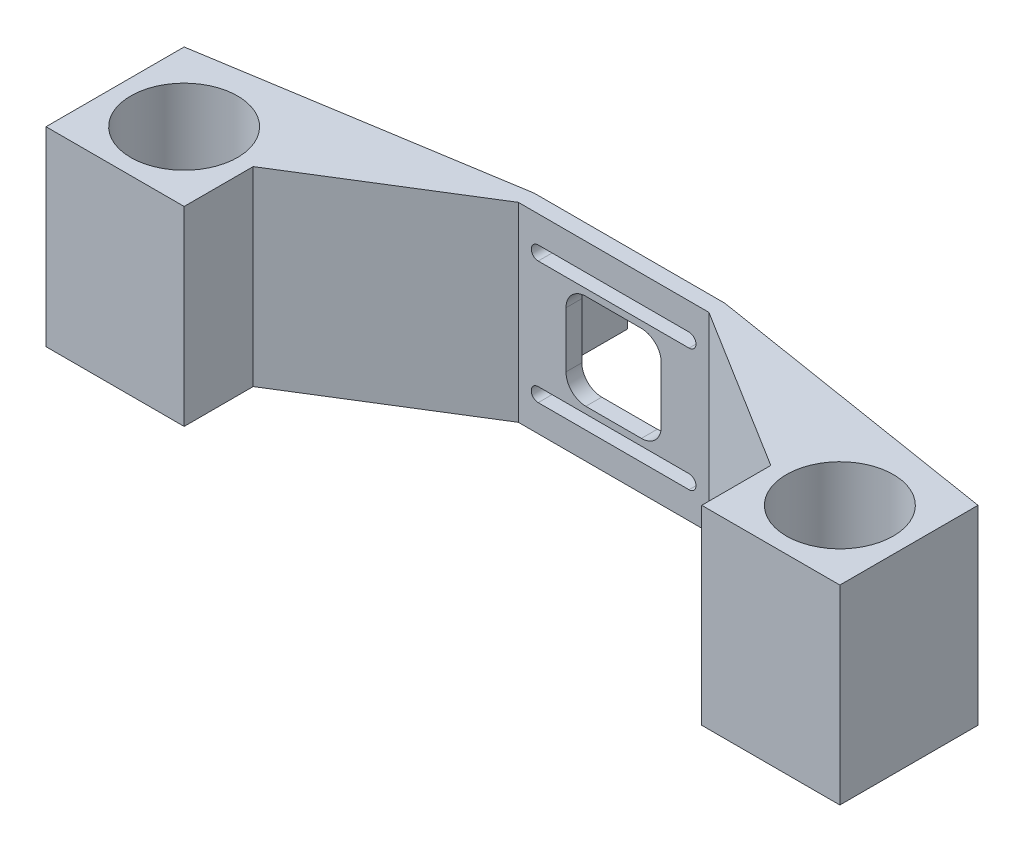
from build123d import *

# Parameters (mm, degrees)
SKETCH2_R                = 13.45
BOSS_EXTRUDE1_DEPTH      = 48
CUT_EXTRUDE1_DEPTH       = 10
BOSS_EXTRUDE2_DEPTH      = 13
BOSS_EXTRUDE2_DEPTH_BACK = 2
SKETCH5_W                = 14
SKETCH5_H                = 14
SKETCH5_R                = 4.1


with BuildPart() as part:
    # Sketch2 → Boss-Extrude1 (new body)
    with BuildSketch(Plane(origin=(0, 0, 0), x_dir=(1, 0, 0), z_dir=(0, 1, 0))):
        Polygon((-17.4, -17.4), (17.4, -17.4), (17.4, 0), (58.6, 25.6), (82.6, 25.6), (82.6, 29.6), (58.6, 29.6), (-17.4, 17.4), align=None)
        with Locations(Location((0, 0, 0), (0, 0, 270))):
            Circle(SKETCH2_R, mode=Mode.SUBTRACT)
    boss_extrude1 = extrude(amount=BOSS_EXTRUDE1_DEPTH)

    # Mirror1: Boss-Extrude1 across plane
    add(boss_extrude1.mirror(Plane(origin=(82.6, 0, 0), x_dir=(0, 0, 1), z_dir=(1, 0, 0))))

    # Sketch4 → Cut-Extrude1 (cut)
    with BuildSketch(Plane(origin=(0, 0, -29.6), x_dir=(-1, 0, 0), z_dir=(0, 0, -1))):
        with BuildLine():
            Line((-101.6, 10.3), (-63.6, 10.3))
            ThreePointArc((-63.6, 10.3), (-61.85, 8.55), (-63.6, 6.8))
            Line((-63.6, 6.8), (-101.6, 6.8))
            ThreePointArc((-101.6, 6.8), (-103.35, 8.55), (-101.6, 10.3))
        make_face()
        with BuildLine():
            Line((-101.6, 37.7), (-63.6, 37.7))
            ThreePointArc((-63.6, 37.7), (-61.85, 39.45), (-63.6, 41.2))
            Line((-63.6, 41.2), (-101.6, 41.2))
            ThreePointArc((-101.6, 41.2), (-103.35, 39.45), (-101.6, 37.7))
        make_face()
        with BuildLine():
            Line((-89.6, 12), (-75.6, 12))
            ThreePointArc((-75.6, 12), (-72.064466094, 13.464466094), (-70.6, 17))
            Line((-70.6, 17), (-70.6, 31))
            ThreePointArc((-70.6, 31), (-72.064466094, 34.535533906), (-75.6, 36))
            Line((-75.6, 36), (-89.6, 36))
            ThreePointArc((-89.6, 36), (-93.135533906, 34.535533906), (-94.6, 31))
            Line((-94.6, 31), (-94.6, 17))
            ThreePointArc((-94.6, 17), (-93.135533906, 13.464466094), (-89.6, 12))
        make_face()
    extrude(amount=-CUT_EXTRUDE1_DEPTH, mode=Mode.SUBTRACT)

    # Sketch5 → Boss-Extrude2 (add, two sides: drawn at the far end of the back side and taken through both)
    with BuildSketch(Plane(origin=(0, 0, -29.6), x_dir=(-1, 0, 0), z_dir=(0, 0, -1)).offset(-BOSS_EXTRUDE2_DEPTH_BACK)):
        with Locations((-62.1, 24.09990131)):
            Rectangle(SKETCH5_W, SKETCH5_H)
        with Locations((-62.1, 24.09990131)):
            Circle(SKETCH5_R, mode=Mode.SUBTRACT)
    extrude(amount=BOSS_EXTRUDE2_DEPTH + BOSS_EXTRUDE2_DEPTH_BACK)


solid = part.part
